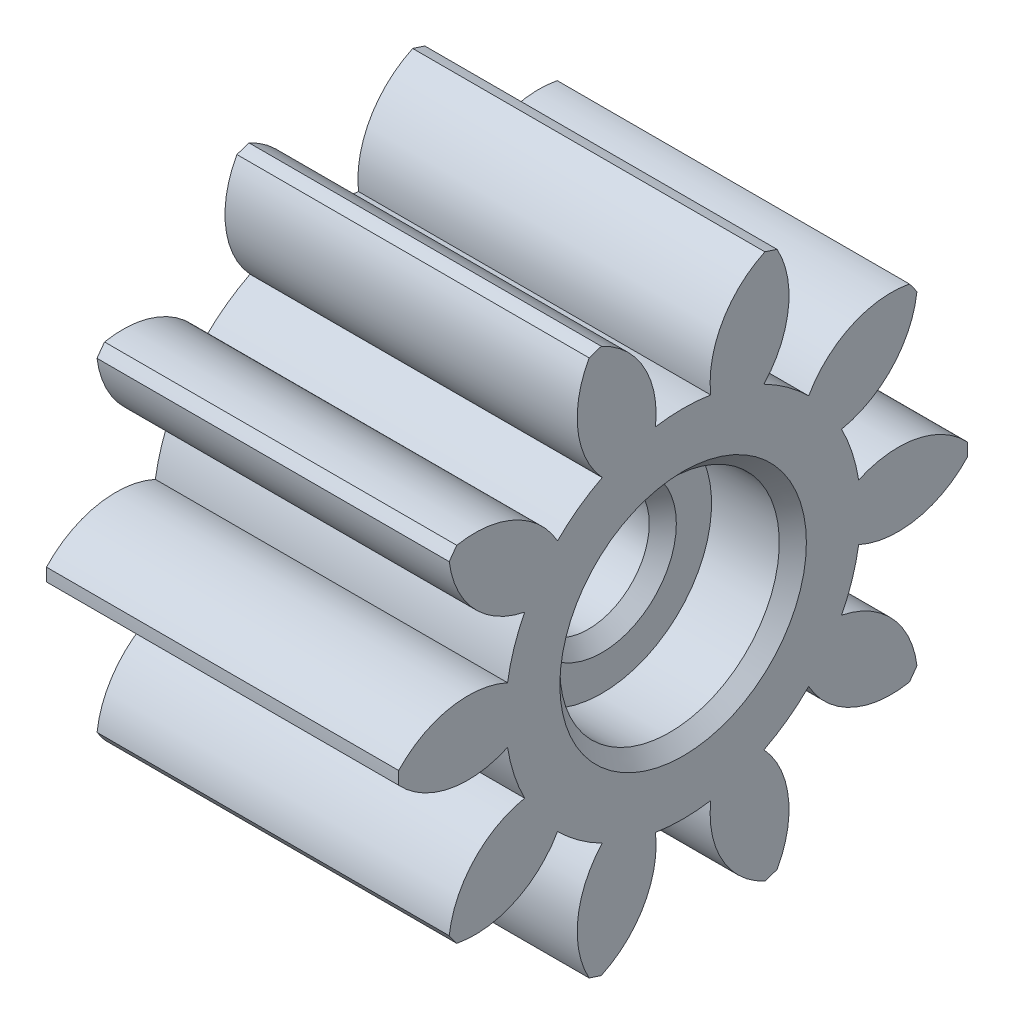
from build123d import *

# Parameters (mm, degrees)
BASPROSKE_W        = 13
BASPROSKE_H        = 10.5
TOOTHCUT_DEPTH     = 20.735754356
TEETHCUTS_COUNT    = 10
TEETHCUTS_ANGLE    = 324
BORSKE_R           = 1.5
BORE_DEPTH         = 50.0000508
SKETCH1_R          = 4.05
CUT_EXTRUDE1_DEPTH = 3
CUT_EXTRUDE2_REACH = 19.646
SKETCH2_R          = 2.25
CHAMFER1_SIZE      = 0.5


with BuildPart() as part:
    # BasProSke → Base-Revolve (revolve)
    with BuildSketch(Plane(origin=(0, 0, 0), x_dir=(1, 0, 0), z_dir=(0, 1, 0)), mode=Mode.PRIVATE) as base_revolve_sk:
        with Locations((6.5, 5.25)):
            Rectangle(BASPROSKE_W, BASPROSKE_H)
    revolve(base_revolve_sk.sketch.rotate(Axis((-10, 0, 0), (1, 0, 0)), 180), axis=Axis((-10, 0, 0), (1, 0, 0)))

    # TooCutSke → ToothCut (cut, through all)
    with BuildSketch(Plane(origin=(0, 0, 0), x_dir=(0, 0, -1), z_dir=(1, 0, 0))):
        with BuildLine():
            ThreePointArc((1.019600066, 6.481797432), (0, 6.5615), (-1.019600066, 6.481797432))
            ThreePointArc((-1.019600066, 6.481797432), (-1.451036104, 8.608938557), (-3.053606956, 10.072712133))
            ThreePointArc((-3.053606956, 10.072712133), (0, 10.5254), (3.053606956, 10.072712133))
            ThreePointArc((3.053606956, 10.072712133), (1.451036104, 8.608938557), (1.019600066, 6.481797432))
        make_face()
    toothcut = extrude(amount=TOOTHCUT_DEPTH, mode=Mode.SUBTRACT)

    # TeethCuts: ToothCut ×10 about axis
    teethcuts_axis = Axis((-10, 0, 0), (1, 0, 0))
    for i in range(1, TEETHCUTS_COUNT):
        add(toothcut.rotate(teethcuts_axis, i * TEETHCUTS_ANGLE / (TEETHCUTS_COUNT - 1)), mode=Mode.SUBTRACT)

    # BorSke → Bore (cut, symmetric)
    with BuildSketch(Plane(origin=(0, 0, 0), x_dir=(0, 0, -1), z_dir=(1, 0, 0))):
        with Locations(Location((0, 0, 0), (0, 0, 180))):
            Circle(BORSKE_R)
    extrude(amount=BORE_DEPTH, both=True, mode=Mode.SUBTRACT)

    # Sketch1 → Cut-Extrude1 (cut)
    with BuildSketch(Plane.ZY):
        Circle(SKETCH1_R)
    cut_extrude1 = extrude(amount=-CUT_EXTRUDE1_DEPTH, mode=Mode.SUBTRACT)

    # Mirror1: Cut-Extrude1 across plane
    add(cut_extrude1.mirror(Plane(origin=(6.5, 0, 0), x_dir=(0, 0, 1), z_dir=(1, 0, 0))), mode=Mode.SUBTRACT)

    # Sketch2 → Cut-Extrude2 (cut, up to next)
    with BuildSketch(Plane(origin=(10, 0, 0), x_dir=(0, 0, -1), z_dir=(1, 0, 0)), mode=Mode.PRIVATE) as cut_extrude2_sk1:
        Circle(SKETCH2_R)
    cut_extrude2_tool1 = extrude(cut_extrude2_sk1.sketch, amount=-CUT_EXTRUDE2_REACH, mode=Mode.PRIVATE) & part.part
    add(cut_extrude2_tool1.solids().sort_by_distance((10, 0, 0))[0], mode=Mode.SUBTRACT)

    # Chamfer1
    chamfer1_edges = [part.edges().sort_by_distance(p)[0] for p in [
        (0, 0, -4.05),
        (13, 0, -4.05),
        (3, 0, 2.25),
        (10, 0, 2.25),
    ]]
    chamfer(chamfer1_edges, length=CHAMFER1_SIZE)


solid = part.part
